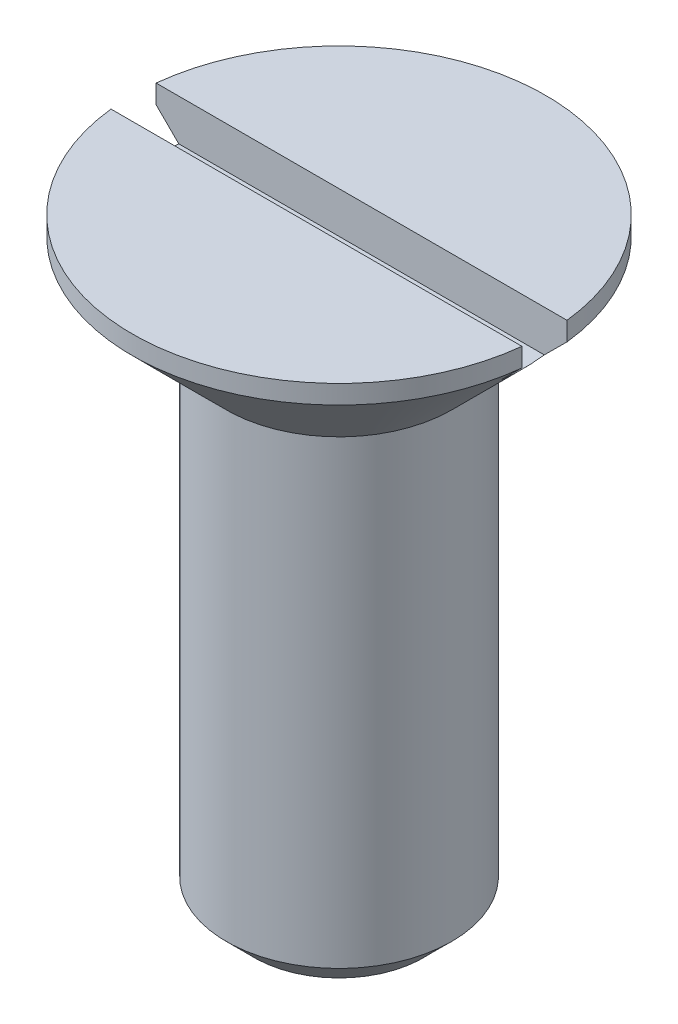
from build123d import *

# Parameters (mm, degrees)
SKETCH_13_W         = 12
SKETCH_13_H         = 1.2
CUT_EXTRUDE_9_DEPTH = 1.1
CHAMFER_1_SIZE      = 0.75


with BuildPart() as part:
    # Эскиз1 → Повернуть1 (revolve)
    with BuildSketch(Plane.XY):
        Polygon((0, 16), (0, 0), (3, 0), (3, 13), (5.5, 15.5), (5.5, 16), align=None)
    revolve(axis=Axis((0, 125.763182898, 0), (0, -1, 0)))

    # Эскиз13 → Вырез-Вытянуть9 (cut)
    with BuildSketch(Plane(origin=(0, 16, 0), x_dir=(-1, 0, 0), z_dir=(0, 1, 0))):
        Rectangle(SKETCH_13_W, SKETCH_13_H)
    extrude(amount=-CUT_EXTRUDE_9_DEPTH, mode=Mode.SUBTRACT)

    # Фаска1
    chamfer_1_edges = [part.edges().sort_by_distance(p)[0] for p in [
        (-3, 0, 0),
    ]]
    chamfer(chamfer_1_edges, length=CHAMFER_1_SIZE)


solid = part.part
